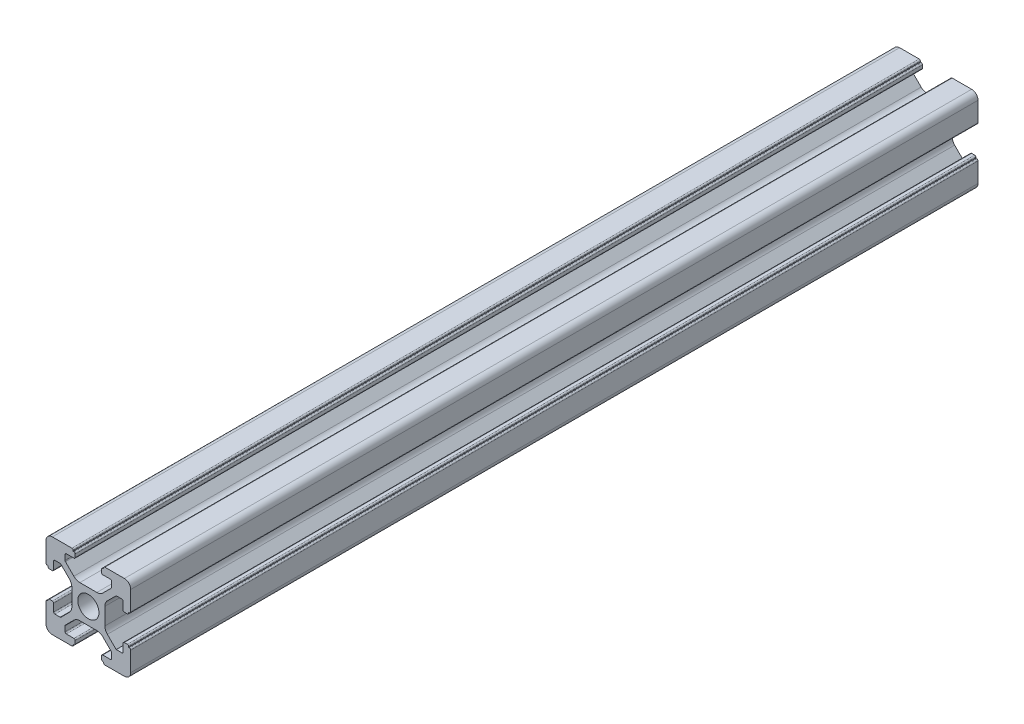
from build123d import *

# Parameters (mm, degrees)
SKETCH_1_R      = 2.5
EXTRUDE_1_DEPTH = 200


with BuildPart() as part:
    # 草图1 → 凸台-拉伸1 (new body)
    with BuildSketch(Plane.XY):
        with BuildLine():
            Line((3.9, 0), (3.9, -2.010912703))
            ThreePointArc((3.9, -2.010912703), (4.052240935, -2.776279568), (4.485786438, -3.425126266))
            Line((4.485786438, -3.425126266), (6.560660172, -5.5))
            Line((6.560660172, -5.5), (7.9, -5.5))
            ThreePointArc((7.9, -5.5), (8.112132034, -5.412132034), (8.2, -5.2))
            Line((8.2, -5.2), (8.2, -3.4))
            ThreePointArc((8.2, -3.4), (8.287867966, -3.187867966), (8.5, -3.1))
            Line((8.5, -3.1), (9.2, -3.1))
            ThreePointArc((9.2, -3.1), (9.412132034, -3.187867966), (9.5, -3.4))
            Line((9.5, -3.4), (9.5, -3.6))
            Line((9.5, -3.6), (9.7, -3.6))
            ThreePointArc((9.7, -3.6), (9.912132034, -3.687867966), (10, -3.9))
            Line((10, -3.9), (10, -8.5))
            ThreePointArc((10, -8.5), (9.560660172, -9.560660172), (8.5, -10))
            Line((8.5, -10), (3.9, -10))
            ThreePointArc((3.9, -10), (3.687867966, -9.912132034), (3.6, -9.7))
            ThreePointArc((3.6, -9.7), (3.541421356, -9.558578644), (3.4, -9.5))
            ThreePointArc((3.4, -9.5), (3.187867966, -9.412132034), (3.1, -9.2))
            Line((3.1, -9.2), (3.1, -8.5))
            ThreePointArc((3.1, -8.5), (3.187867966, -8.287867966), (3.4, -8.2))
            Line((3.4, -8.2), (5.2, -8.2))
            ThreePointArc((5.2, -8.2), (5.412132034, -8.112132034), (5.5, -7.9))
            Line((5.5, -7.9), (5.5, -6.68492424))
            ThreePointArc((5.5, -6.68492424), (5.47716386, -6.570119211), (5.412132034, -6.472792206))
            Line((5.412132034, -6.472792206), (3.425126266, -4.485786438))
            ThreePointArc((3.425126266, -4.485786438), (2.776279568, -4.052240935), (2.010912703, -3.9))
            Line((2.010912703, -3.9), (0, -3.9))
            Line((0, -3.9), (-2.010912703, -3.9))
            ThreePointArc((-2.010912703, -3.9), (-2.776279568, -4.052240935), (-3.425126266, -4.485786438))
            Line((-3.425126266, -4.485786438), (-5.412132034, -6.472792206))
            ThreePointArc((-5.412132034, -6.472792206), (-5.47716386, -6.570119211), (-5.5, -6.68492424))
            Line((-5.5, -6.68492424), (-5.5, -7.9))
            ThreePointArc((-5.5, -7.9), (-5.412132034, -8.112132034), (-5.2, -8.2))
            Line((-5.2, -8.2), (-3.4, -8.2))
            ThreePointArc((-3.4, -8.2), (-3.187867966, -8.287867966), (-3.1, -8.5))
            Line((-3.1, -8.5), (-3.1, -9.2))
            ThreePointArc((-3.1, -9.2), (-3.187867966, -9.412132034), (-3.4, -9.5))
            ThreePointArc((-3.4, -9.5), (-3.541421356, -9.558578644), (-3.6, -9.7))
            ThreePointArc((-3.6, -9.7), (-3.687867966, -9.912132034), (-3.9, -10))
            Line((-3.9, -10), (-8.5, -10))
            ThreePointArc((-8.5, -10), (-9.560660172, -9.560660172), (-10, -8.5))
            Line((-10, -8.5), (-10, -3.9))
            ThreePointArc((-10, -3.9), (-9.912132034, -3.687867966), (-9.7, -3.6))
            Line((-9.7, -3.6), (-9.5, -3.6))
            Line((-9.5, -3.6), (-9.5, -3.4))
            ThreePointArc((-9.5, -3.4), (-9.412132034, -3.187867966), (-9.2, -3.1))
            Line((-9.2, -3.1), (-8.5, -3.1))
            ThreePointArc((-8.5, -3.1), (-8.287867965, -3.187867966), (-8.2, -3.4))
            Line((-8.2, -3.4), (-8.2, -5.2))
            ThreePointArc((-8.2, -5.2), (-8.112132034, -5.412132034), (-7.9, -5.5))
            Line((-7.9, -5.5), (-6.68492424, -5.5))
            ThreePointArc((-6.68492424, -5.5), (-6.570119211, -5.47716386), (-6.472792206, -5.412132034))
            Line((-6.472792206, -5.412132034), (-4.485786438, -3.425126266))
            ThreePointArc((-4.485786438, -3.425126266), (-4.052240935, -2.776279568), (-3.9, -2.010912703))
            Line((-3.9, -2.010912703), (-3.9, 0))
            Line((-3.9, 0), (-3.9, 2.010912703))
            ThreePointArc((-3.9, 2.010912703), (-4.052240935, 2.776279568), (-4.485786438, 3.425126266))
            Line((-4.485786438, 3.425126266), (-6.472792206, 5.412132034))
            ThreePointArc((-6.472792206, 5.412132034), (-6.570119211, 5.47716386), (-6.68492424, 5.5))
            Line((-6.68492424, 5.5), (-7.9, 5.5))
            ThreePointArc((-7.9, 5.5), (-8.112132034, 5.412132034), (-8.2, 5.2))
            Line((-8.2, 5.2), (-8.2, 3.4))
            ThreePointArc((-8.2, 3.4), (-8.287867965, 3.187867966), (-8.5, 3.1))
            Line((-8.5, 3.1), (-9.2, 3.1))
            ThreePointArc((-9.2, 3.1), (-9.412132034, 3.187867966), (-9.5, 3.4))
            Line((-9.5, 3.4), (-9.5, 3.6))
            Line((-9.5, 3.6), (-9.7, 3.6))
            ThreePointArc((-9.7, 3.6), (-9.912132034, 3.687867966), (-10, 3.9))
            Line((-10, 3.9), (-10, 8.5))
            ThreePointArc((-10, 8.5), (-9.560660172, 9.560660172), (-8.5, 10))
            Line((-8.5, 10), (-3.9, 10))
            ThreePointArc((-3.9, 10), (-3.687867966, 9.912132034), (-3.6, 9.7))
            Line((-3.6, 9.7), (-3.6, 9.5))
            Line((-3.6, 9.5), (-3.4, 9.5))
            ThreePointArc((-3.4, 9.5), (-3.187867966, 9.412132034), (-3.1, 9.2))
            Line((-3.1, 9.2), (-3.1, 8.5))
            ThreePointArc((-3.1, 8.5), (-3.187867966, 8.287867966), (-3.4, 8.2))
            Line((-3.4, 8.2), (-5.2, 8.2))
            ThreePointArc((-5.2, 8.2), (-5.412132034, 8.112132034), (-5.5, 7.9))
            Line((-5.5, 7.9), (-5.5, 6.68492424))
            ThreePointArc((-5.5, 6.68492424), (-5.47716386, 6.570119211), (-5.412132034, 6.472792206))
            Line((-5.412132034, 6.472792206), (-3.425126266, 4.485786438))
            ThreePointArc((-3.425126266, 4.485786438), (-2.776279568, 4.052240935), (-2.010912703, 3.9))
            Line((-2.010912703, 3.9), (0, 3.9))
            Line((0, 3.9), (2.010912703, 3.9))
            ThreePointArc((2.010912703, 3.9), (2.776279568, 4.052240935), (3.425126266, 4.485786438))
            Line((3.425126266, 4.485786438), (5.412132034, 6.472792206))
            ThreePointArc((5.412132034, 6.472792206), (5.47716386, 6.570119211), (5.5, 6.68492424))
            Line((5.5, 6.68492424), (5.5, 7.9))
            ThreePointArc((5.5, 7.9), (5.412132034, 8.112132034), (5.2, 8.2))
            Line((5.2, 8.2), (3.4, 8.2))
            ThreePointArc((3.4, 8.2), (3.187867966, 8.287867966), (3.1, 8.5))
            Line((3.1, 8.5), (3.1, 9.2))
            ThreePointArc((3.1, 9.2), (3.187867966, 9.412132034), (3.4, 9.5))
            Line((3.4, 9.5), (3.6, 9.5))
            Line((3.6, 9.5), (3.6, 9.7))
            ThreePointArc((3.6, 9.7), (3.687867966, 9.912132034), (3.9, 10))
            Line((3.9, 10), (8.5, 10))
            ThreePointArc((8.5, 10), (9.560660172, 9.560660172), (10, 8.5))
            Line((10, 8.5), (10, 3.9))
            ThreePointArc((10, 3.9), (9.912132034, 3.687867966), (9.7, 3.6))
            Line((9.7, 3.6), (9.5, 3.6))
            Line((9.5, 3.6), (9.5, 3.4))
            ThreePointArc((9.5, 3.4), (9.412132034, 3.187867966), (9.2, 3.1))
            Line((9.2, 3.1), (8.5, 3.1))
            ThreePointArc((8.5, 3.1), (8.287867966, 3.187867966), (8.2, 3.4))
            Line((8.2, 3.4), (8.2, 5.2))
            ThreePointArc((8.2, 5.2), (8.112132034, 5.412132034), (7.9, 5.5))
            Line((7.9, 5.5), (6.68492424, 5.5))
            ThreePointArc((6.68492424, 5.5), (6.570119211, 5.47716386), (6.472792206, 5.412132034))
            Line((6.472792206, 5.412132034), (4.485786438, 3.425126266))
            ThreePointArc((4.485786438, 3.425126266), (4.052240935, 2.776279568), (3.9, 2.010912703))
            Line((3.9, 2.010912703), (3.9, 0))
        make_face()
        Circle(SKETCH_1_R, mode=Mode.SUBTRACT)
    extrude(amount=EXTRUDE_1_DEPTH)


solid = part.part
